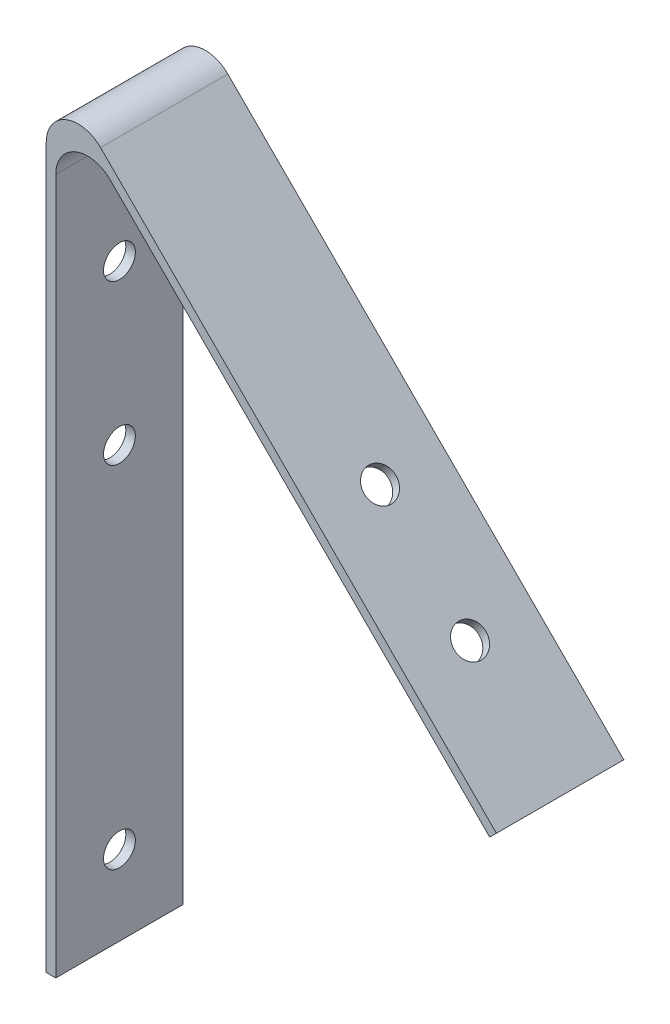
from build123d import *

# Parameters (mm, degrees)
BOSS_EXTRUDE1_DEPTH = 40
SKETCH2_R           = 5
CUT_EXTRUDE1_DEPTH  = 40
SKETCH3_R           = 5
CUT_EXTRUDE2_DEPTH  = 40


with BuildPart() as part:
    # Sketch1 → Boss-Extrude1 (new body)
    with BuildSketch(Plane.XY):
        with BuildLine():
            Line((0, 0), (0, 225.857864376))
            ThreePointArc((0, 225.857864376), (6.173165676, 235.096659701), (17.071067812, 232.928932188))
            Line((17.071067812, 232.928932188), (141.421356237, 108.578643763))
            Line((141.421356237, 108.578643763), (139.300035894, 106.457323419))
            Line((139.300035894, 106.457323419), (20.071067812, 225.686291501))
            ThreePointArc((20.071067812, 225.686291501), (9.173165676, 227.854019014), (3, 218.615223689))
            Line((3, 218.615223689), (3, 0))
            Line((3, 0), (0, 0))
        make_face()
    extrude(amount=BOSS_EXTRUDE1_DEPTH)

    # Sketch2 → Cut-Extrude1 (cut)
    with BuildSketch(Plane(origin=(3, 0, 0), x_dir=(0, 0, -1), z_dir=(1, 0, 0))):
        with Locations(Location((-20, 185, 0), (0, 0, 90))):
            Circle(SKETCH2_R)
        with Locations(Location((-20, 25, 0), (0, 0, 90))):
            Circle(SKETCH2_R)
        with Locations(Location((-20, 135, 0), (0, 0, 90))):
            Circle(SKETCH2_R)
    extrude(amount=-CUT_EXTRUDE1_DEPTH, mode=Mode.SUBTRACT)

    # Sketch3 → Cut-Extrude2 (cut)
    with BuildSketch(Plane(origin=(125, 125, 0), x_dir=(0, 0, -1), z_dir=(0.7071067811865509, 0.7071067811865441, 0))):
        with Locations(Location((-20, 16.776695297, 0), (0, 0, 90))):
            Circle(SKETCH3_R)
        with Locations(Location((-20, 56.776695297, 0), (0, 0, 90))):
            Circle(SKETCH3_R)
    extrude(amount=-CUT_EXTRUDE2_DEPTH, mode=Mode.SUBTRACT)


solid = part.part
